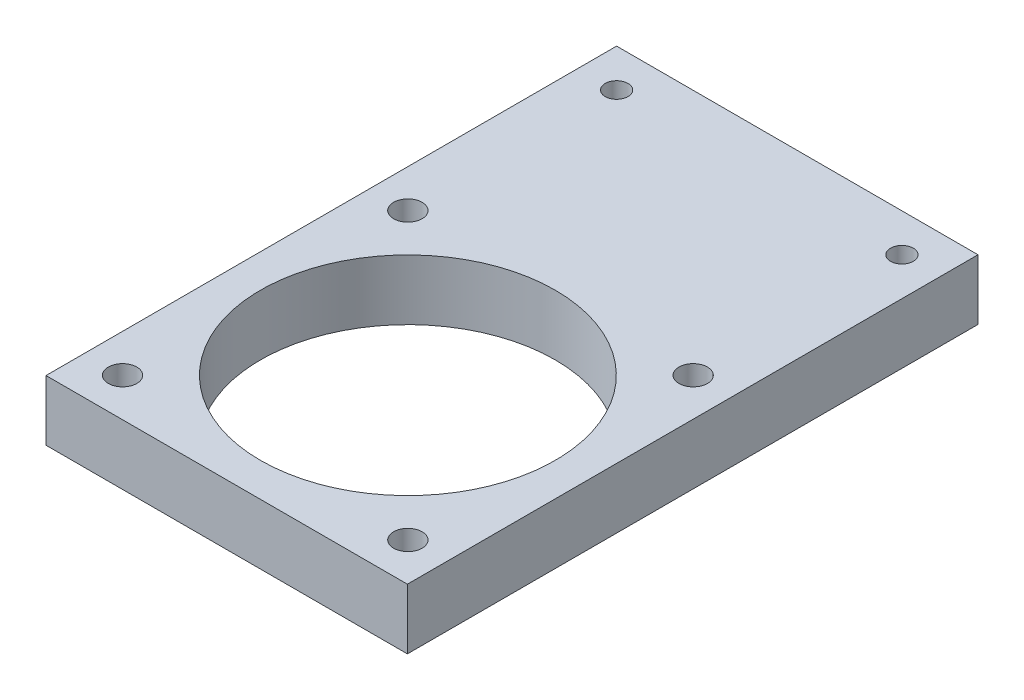
from build123d import *

# Parameters (mm, degrees)
SKETCH1_W           = 38
SKETCH1_H           = 60
SKETCH1_R           = 1.5
SKETCH1_R_2         = 15.5
SKETCH1_R_3         = 1.2
BOSS_EXTRUDE1_DEPTH = 6.35


with BuildPart() as part:
    # Sketch1 → Boss-Extrude1 (new body)
    with BuildSketch(Plane(origin=(0, 0, 0), x_dir=(1, 0, 0), z_dir=(0, 1, 0))):
        with Locations((19, 30)):
            Rectangle(SKETCH1_W, SKETCH1_H)
        with Locations(Location((4, 4.05, 0), (0, 0, 270))):
            Circle(SKETCH1_R, mode=Mode.SUBTRACT)
        with Locations(Location((34, 4.05, 0), (0, 0, 270))):
            Circle(SKETCH1_R, mode=Mode.SUBTRACT)
        with Locations(Location((34, 34.05, 0), (0, 0, 270))):
            Circle(SKETCH1_R, mode=Mode.SUBTRACT)
        with Locations(Location((4, 34.05, 0), (0, 0, 270))):
            Circle(SKETCH1_R, mode=Mode.SUBTRACT)
        with Locations(Location((19, 19.05, 0), (0, 0, 270))):
            Circle(SKETCH1_R_2, mode=Mode.SUBTRACT)
        with Locations(Location((4, 56, 0), (0, 0, 270))):
            Circle(SKETCH1_R_3, mode=Mode.SUBTRACT)
        with Locations(Location((34, 56, 0), (0, 0, 270))):
            Circle(SKETCH1_R_3, mode=Mode.SUBTRACT)
    extrude(amount=BOSS_EXTRUDE1_DEPTH)


solid = part.part
